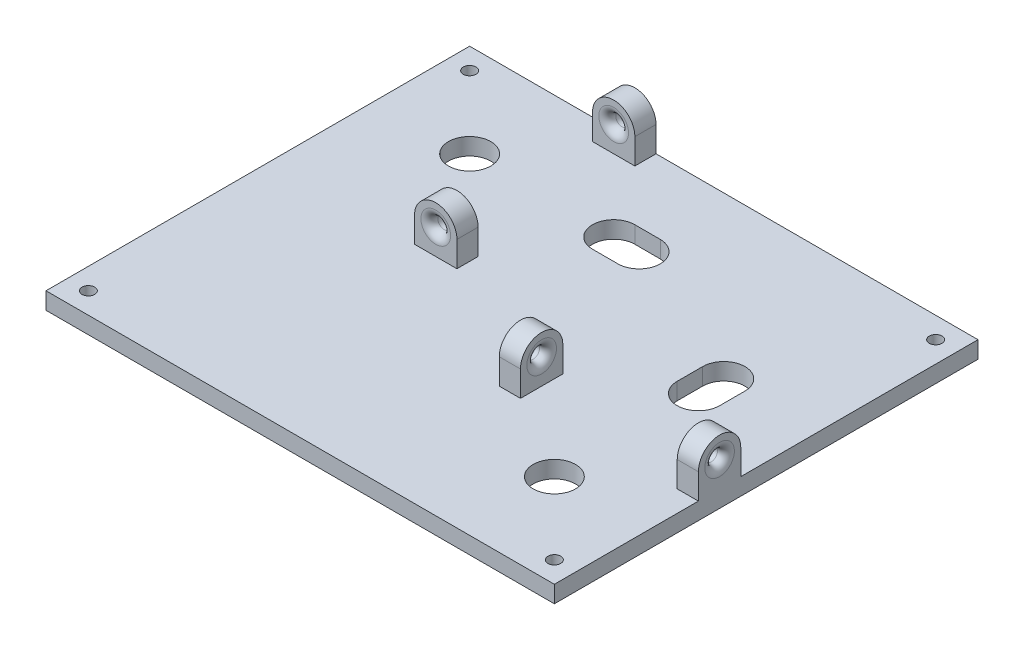
from build123d import *

# Parameters (mm, degrees)
SKETCH2_W           = 120
SKETCH2_H           = 100
BOSS_EXTRUDE1_DEPTH = 4
SKETCH3_R           = 1.5
CUT_EXTRUDE1_DEPTH  = 5
SKETCH4_R           = 5
CUT_EXTRUDE2_DEPTH  = 5
CUT_EXTRUDE3_DEPTH  = 10
SKETCH6_W           = 10
SKETCH6_H           = 5
SKETCH6_W_2         = 5
SKETCH6_H_2         = 10
BOSS_EXTRUDE2_DEPTH = 15
SKETCH7_R           = 1.5
CUT_EXTRUDE4_DEPTH  = 83.280009723
SKETCH8_R           = 1.5
CUT_EXTRUDE5_DEPTH  = 99.28021164
FILLET1_R           = 2


with BuildPart() as part:
    # Sketch2 → Boss-Extrude1 (new body)
    with BuildSketch(Plane(origin=(0, 0, 0), x_dir=(1, 0, 0), z_dir=(0, 1, 0))):
        Rectangle(SKETCH2_W, SKETCH2_H)
    extrude(amount=BOSS_EXTRUDE1_DEPTH)

    # Sketch3 → Cut-Extrude1 (cut)
    with BuildSketch(Plane(origin=(0, 4, 0), x_dir=(1, 0, 0), z_dir=(0, 1, 0))):
        with Locations(Location((-55, 45, 0), (0, 0, 270))):
            Circle(SKETCH3_R)
        with Locations(Location((55, 45, 0), (0, 0, 270))):
            Circle(SKETCH3_R)
        with Locations(Location((55, -45, 0), (0, 0, 270))):
            Circle(SKETCH3_R)
        with Locations(Location((-55, -45, 0), (0, 0, 270))):
            Circle(SKETCH3_R)
    extrude(amount=-CUT_EXTRUDE1_DEPTH, mode=Mode.SUBTRACT)

    # Sketch4 → Cut-Extrude2 (cut)
    with BuildSketch(Plane(origin=(0, 4, 0), x_dir=(1, 0, 0), z_dir=(0, 1, 0))):
        with Locations(Location((-38, 28, 0), (0, 0, 270))):
            Circle(SKETCH4_R)
        with Locations(Location((-4, 28, 0), (0, 0, 270))):
            Circle(SKETCH4_R)
        with Locations(Location((38, 6, 0), (0, 0, 270))):
            Circle(SKETCH4_R)
        with Locations(Location((38, -28, 0), (0, 0, 270))):
            Circle(SKETCH4_R)
    extrude(amount=-CUT_EXTRUDE2_DEPTH, mode=Mode.SUBTRACT)

    # Sketch5 → Cut-Extrude3 (cut)
    with BuildSketch(Plane(origin=(0, 4, 0), x_dir=(1, 0, 0), z_dir=(0, 1, 0))):
        with BuildLine():
            Line((-4, 33), (2, 33))
            ThreePointArc((2, 33), (7, 28), (2, 23))
            Line((2, 23), (-4, 23))
            ThreePointArc((-4, 23), (-9, 28), (-4, 33))
        make_face()
        with BuildLine():
            Line((33, 6), (33, 12))
            ThreePointArc((33, 12), (38, 17), (43, 12))
            Line((43, 12), (43, 6))
            ThreePointArc((43, 6), (38, 1), (33, 6))
        make_face()
    extrude(amount=-CUT_EXTRUDE3_DEPTH, mode=Mode.SUBTRACT)

    # Sketch6 → Boss-Extrude2 (add)
    with BuildSketch(Plane(origin=(0, 4, 0), x_dir=(1, 0, 0), z_dir=(0, 1, 0))):
        with Locations((-21, 5.5)):
            Rectangle(SKETCH6_W, SKETCH6_H)
        with Locations((57.5, -11)):
            Rectangle(SKETCH6_W_2, SKETCH6_H_2)
        with Locations((-21, 47.5)):
            Rectangle(SKETCH6_W, SKETCH6_H)
        with Locations((15.5, -11)):
            Rectangle(SKETCH6_W_2, SKETCH6_H_2)
    extrude(amount=BOSS_EXTRUDE2_DEPTH)

    # Sketch7 → Cut-Extrude4 (cut, through all)
    with BuildSketch(Plane.XY.offset(-3)):
        with Locations((-21, 10)):
            Circle(SKETCH7_R)
        with BuildLine():
            Line((-16, 10), (-16, 19))
            Line((-16, 19), (-26, 19))
            Line((-26, 19), (-26, 10))
            ThreePointArc((-26, 10), (-21, 15), (-16, 10))
        make_face()
    extrude(amount=-CUT_EXTRUDE4_DEPTH, mode=Mode.SUBTRACT)

    # Sketch8 → Cut-Extrude5 (cut, through all)
    with BuildSketch(Plane(origin=(13, 0, -13), x_dir=(0, 0, 1), z_dir=(-1, 0, 0))):
        with Locations((24, 10)):
            Circle(SKETCH8_R)
        with BuildLine():
            Line((29, 10), (29, 19))
            Line((29, 19), (19, 19))
            Line((19, 19), (19, 10))
            ThreePointArc((19, 10), (24, 15), (29, 10))
        make_face()
    extrude(amount=-CUT_EXTRUDE5_DEPTH, mode=Mode.SUBTRACT)

    # Fillet1
    fillet1_edges = [part.edges().sort_by_distance(p)[0] for p in [
        (-22.5, 10, -8),
        (-22.5, 10, -50),
        (-22.5, 10, -45),
        (-22.5, 10, -3),
        (60, 10, 9.5),
        (55, 10, 9.5),
        (18, 10, 9.5),
        (13, 10, 9.5),
    ]]
    fillet(fillet1_edges, radius=FILLET1_R)


solid = part.part
